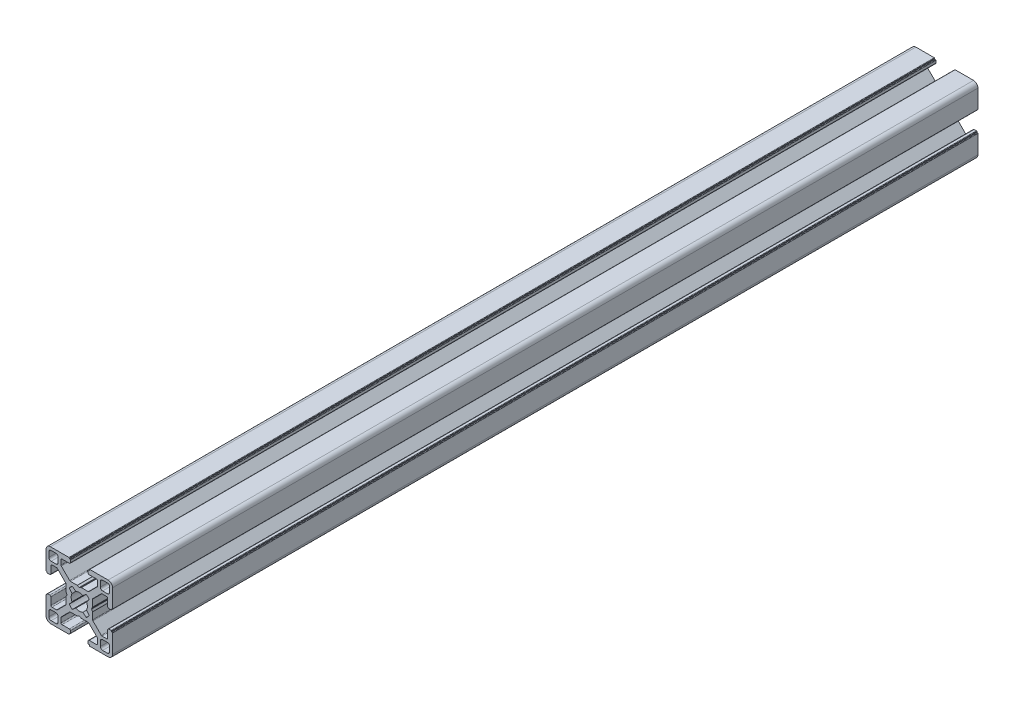
from build123d import *

# Parameters (mm, degrees)
SALIENTE_EXTRUIR1_DEPTH = 1000
CORTAR_EXTRUIR1_START   = -610
CORTAR_EXTRUIR1_DEPTH   = 610


with BuildPart() as part:
    # Croquis1 → Saliente-Extruir1 (new body)
    with BuildSketch(Plane.XY.offset(1000)):
        with BuildLine():
            Line((9.800000436, -10.500000436), (10.100000436, -10.500000436))
            ThreePointArc((10.100000436, -10.500000436), (10.241421792, -10.441421792), (10.300000436, -10.300000436))
            Line((10.300000436, -10.300000436), (10.300000436, -2))
            ThreePointArc((10.300000436, -2), (9.714213998, -0.585786438), (8.300000436, 0))
            Line((8.300000436, 0), (0, 0))
            ThreePointArc((0, 0), (-0.141421356, -0.058578644), (-0.2, -0.2))
            Line((-0.2, -0.2), (-0.2, -0.5))
            Line((-0.2, -0.5), (-0.49999919, -0.5))
            ThreePointArc((-0.49999919, -0.5), (-0.641420811, -0.558578753), (-0.699999564, -0.700000374))
            Line((-0.699999564, -0.700000374), (-0.699999564, -1.700000763))
            ThreePointArc((-0.699999564, -1.700000763), (-0.553552955, -2.053554154), (-0.199999564, -2.200000763))
            Line((-0.199999564, -2.200000763), (3.050000763, -2.200000763))
            ThreePointArc((3.050000763, -2.200000763), (3.403554154, -2.346447372), (3.550000763, -2.700000763))
            Line((3.550000763, -2.700000763), (3.550000763, -4.743055509))
            ThreePointArc((3.550000763, -4.743055509), (3.511993279, -4.934269826), (3.403749103, -5.096413843))
            Line((3.403749103, -5.096413843), (-0.349053376, -8.853358334))
            ThreePointArc((-0.349053376, -8.853358334), (-0.511332616, -8.961886981), (-0.702801716, -9))
            Line((-0.702801716, -9), (-3.746809419, -9))
            ThreePointArc((-3.746809419, -9), (-3.798212795, -9.006718618), (-3.846162576, -9.026423071))
            Line((-3.846162576, -9.026423071), (-4.600646407, -9.458279719))
            ThreePointArc((-4.600646407, -9.458279719), (-4.699999564, -9.48470279), (-4.799352721, -9.458279719))
            Line((-4.799352721, -9.458279719), (-5.553836552, -9.026423071))
            ThreePointArc((-5.553836552, -9.026423071), (-5.601786333, -9.006718618), (-5.653189709, -9))
            Line((-5.653189709, -9), (-8.697197412, -9))
            ThreePointArc((-8.697197412, -9), (-8.888666513, -8.961886981), (-9.050945752, -8.853358334))
            Line((-9.050945752, -8.853358334), (-12.803748231, -5.096413843))
            ThreePointArc((-12.803748231, -5.096413843), (-12.911992407, -4.934269826), (-12.949999891, -4.743055509))
            Line((-12.949999891, -4.743055509), (-12.949999891, -2.700000763))
            ThreePointArc((-12.949999891, -2.700000763), (-12.803553282, -2.346447372), (-12.449999891, -2.200000763))
            Line((-12.449999891, -2.200000763), (-9.199999564, -2.200000763))
            ThreePointArc((-9.199999564, -2.200000763), (-8.846446173, -2.053554154), (-8.699999564, -1.700000763))
            Line((-8.699999564, -1.700000763), (-8.699999564, -0.700000374))
            ThreePointArc((-8.699999564, -0.700000374), (-8.758578317, -0.558578753), (-8.899999938, -0.5))
            Line((-8.899999938, -0.5), (-9.199999128, -0.5))
            Line((-9.199999128, -0.5), (-9.199999128, -0.2))
            ThreePointArc((-9.199999128, -0.2), (-9.258577772, -0.058578644), (-9.399999128, 0))
            Line((-9.399999128, 0), (-17.699999564, 0))
            ThreePointArc((-17.699999564, 0), (-19.114213126, -0.585786438), (-19.699999564, -2))
            Line((-19.699999564, -2), (-19.699999564, -10.300000436))
            ThreePointArc((-19.699999564, -10.300000436), (-19.64142092, -10.441421792), (-19.499999564, -10.500000436))
            Line((-19.499999564, -10.500000436), (-19.199999564, -10.500000436))
            Line((-19.199999564, -10.500000436), (-19.199999564, -10.799999627))
            ThreePointArc((-19.199999564, -10.799999627), (-19.141420811, -10.941421247), (-18.99999919, -11))
            Line((-18.99999919, -11), (-17.999998801, -11))
            ThreePointArc((-17.999998801, -11), (-17.64644541, -10.853553391), (-17.499998801, -10.5))
            Line((-17.499998801, -10.5), (-17.499998801, -7.249999673))
            ThreePointArc((-17.499998801, -7.249999673), (-17.353552192, -6.896446283), (-16.999998801, -6.749999673))
            Line((-16.999998801, -6.749999673), (-14.956944055, -6.749999673))
            ThreePointArc((-14.956944055, -6.749999673), (-14.765729738, -6.788007157), (-14.603585721, -6.896251334))
            Line((-14.603585721, -6.896251334), (-10.84664123, -10.649053813))
            ThreePointArc((-10.84664123, -10.649053813), (-10.738112583, -10.811333052), (-10.699999564, -11.002802152))
            Line((-10.699999564, -11.002802152), (-10.699999564, -14.046809855))
            ThreePointArc((-10.699999564, -14.046809855), (-10.693280947, -14.098213232), (-10.673576493, -14.146163012))
            Line((-10.673576493, -14.146163012), (-10.241719845, -14.900646843))
            ThreePointArc((-10.241719845, -14.900646843), (-10.215296774, -15), (-10.241719845, -15.099353157))
            Line((-10.241719845, -15.099353157), (-10.673576493, -15.853836988))
            ThreePointArc((-10.673576493, -15.853836988), (-10.693280947, -15.901786769), (-10.699999564, -15.953190146))
            Line((-10.699999564, -15.953190146), (-10.699999564, -18.997197848))
            ThreePointArc((-10.699999564, -18.997197848), (-10.738112583, -19.188666949), (-10.84664123, -19.350946188))
            Line((-10.84664123, -19.350946188), (-14.603585721, -23.103748667))
            ThreePointArc((-14.603585721, -23.103748667), (-14.765729738, -23.211992843), (-14.956944055, -23.250000327))
            Line((-14.956944055, -23.250000327), (-16.999998801, -23.250000327))
            ThreePointArc((-16.999998801, -23.250000327), (-17.353552192, -23.103553718), (-17.499998801, -22.750000327))
            Line((-17.499998801, -22.750000327), (-17.499998801, -19.5))
            ThreePointArc((-17.499998801, -19.5), (-17.64644541, -19.14644661), (-17.999998801, -19))
            Line((-17.999998801, -19), (-18.99999919, -19))
            ThreePointArc((-18.99999919, -19), (-19.141420811, -19.058578753), (-19.199999564, -19.200000374))
            Line((-19.199999564, -19.200000374), (-19.199999564, -19.499999564))
            Line((-19.199999564, -19.499999564), (-19.499999564, -19.499999564))
            ThreePointArc((-19.499999564, -19.499999564), (-19.64142092, -19.558578208), (-19.699999564, -19.699999564))
            Line((-19.699999564, -19.699999564), (-19.699999564, -28))
            ThreePointArc((-19.699999564, -28), (-19.114213126, -29.414213563), (-17.699999564, -30))
            Line((-17.699999564, -30), (-9.399999128, -30))
            ThreePointArc((-9.399999128, -30), (-9.258577772, -29.941421356), (-9.199999128, -29.8))
            Line((-9.199999128, -29.8), (-9.199999128, -29.5))
            Line((-9.199999128, -29.5), (-8.899999938, -29.5))
            ThreePointArc((-8.899999938, -29.5), (-8.758578317, -29.441421247), (-8.699999564, -29.299999627))
            Line((-8.699999564, -29.299999627), (-8.699999564, -28.299999237))
            ThreePointArc((-8.699999564, -28.299999237), (-8.846446173, -27.946445847), (-9.199999564, -27.799999237))
            Line((-9.199999564, -27.799999237), (-12.449999891, -27.799999237))
            ThreePointArc((-12.449999891, -27.799999237), (-12.803553282, -27.653552628), (-12.949999891, -27.299999237))
            Line((-12.949999891, -27.299999237), (-12.949999891, -25.256944491))
            ThreePointArc((-12.949999891, -25.256944491), (-12.911992407, -25.065730174), (-12.803748231, -24.903586157))
            Line((-12.803748231, -24.903586157), (-9.050945752, -21.146641666))
            ThreePointArc((-9.050945752, -21.146641666), (-8.888666513, -21.038113019), (-8.697197412, -21))
            Line((-8.697197412, -21), (-5.653189709, -21))
            ThreePointArc((-5.653189709, -21), (-5.601786333, -20.993281383), (-5.553836552, -20.973576929))
            Line((-5.553836552, -20.973576929), (-4.799352721, -20.541720281))
            ThreePointArc((-4.799352721, -20.541720281), (-4.699999564, -20.51529721), (-4.600646407, -20.541720281))
            Line((-4.600646407, -20.541720281), (-3.846162576, -20.973576929))
            ThreePointArc((-3.846162576, -20.973576929), (-3.798212795, -20.993281383), (-3.746809419, -21))
            Line((-3.746809419, -21), (-0.702801716, -21))
            ThreePointArc((-0.702801716, -21), (-0.511332616, -21.038113019), (-0.349053377, -21.146641666))
            Line((-0.349053377, -21.146641666), (3.403749103, -24.903586157))
            ThreePointArc((3.403749103, -24.903586157), (3.511993279, -25.065730174), (3.550000763, -25.256944491))
            Line((3.550000763, -25.256944491), (3.550000763, -27.299999237))
            ThreePointArc((3.550000763, -27.299999237), (3.403554154, -27.653552628), (3.050000763, -27.799999237))
            Line((3.050000763, -27.799999237), (-0.199999564, -27.799999237))
            ThreePointArc((-0.199999564, -27.799999237), (-0.553552955, -27.946445847), (-0.699999564, -28.299999237))
            Line((-0.699999564, -28.299999237), (-0.699999564, -29.299999627))
            ThreePointArc((-0.699999564, -29.299999627), (-0.641420811, -29.441421247), (-0.49999919, -29.5))
            Line((-0.49999919, -29.5), (-0.2, -29.5))
            Line((-0.2, -29.5), (-0.2, -29.8))
            ThreePointArc((-0.2, -29.8), (-0.141421356, -29.941421356), (0, -30))
            Line((0, -30), (8.300000436, -30))
            ThreePointArc((8.300000436, -30), (9.714213998, -29.414213563), (10.300000436, -28))
            Line((10.300000436, -28), (10.300000436, -19.699999564))
            ThreePointArc((10.300000436, -19.699999564), (10.241421792, -19.558578208), (10.100000436, -19.499999564))
            Line((10.100000436, -19.499999564), (9.800000436, -19.499999564))
            Line((9.800000436, -19.499999564), (9.800000436, -19.200000374))
            ThreePointArc((9.800000436, -19.200000374), (9.741421683, -19.058578753), (9.600000062, -19))
            Line((9.600000062, -19), (8.599999673, -19))
            ThreePointArc((8.599999673, -19), (8.246446283, -19.14644661), (8.099999673, -19.5))
            Line((8.099999673, -19.5), (8.099999673, -22.750000327))
            ThreePointArc((8.099999673, -22.750000327), (7.953553064, -23.103553718), (7.599999673, -23.250000327))
            Line((7.599999673, -23.250000327), (5.556944927, -23.250000327))
            ThreePointArc((5.556944927, -23.250000327), (5.36573061, -23.211992843), (5.203586593, -23.103748667))
            Line((5.203586593, -23.103748667), (1.446642102, -19.350946188))
            ThreePointArc((1.446642102, -19.350946188), (1.338113455, -19.188666949), (1.300000436, -18.997197848))
            Line((1.300000436, -18.997197848), (1.300000436, -15.953190145))
            ThreePointArc((1.300000436, -15.953190145), (1.293281819, -15.901786769), (1.273577365, -15.853836988))
            Line((1.273577365, -15.853836988), (0.841720717, -15.099353157))
            ThreePointArc((0.841720717, -15.099353157), (0.815297646, -15), (0.841720717, -14.900646843))
            Line((0.841720717, -14.900646843), (1.273577365, -14.146163012))
            ThreePointArc((1.273577365, -14.146163012), (1.293281819, -14.098213231), (1.300000436, -14.046809855))
            Line((1.300000436, -14.046809855), (1.300000436, -11.002802152))
            ThreePointArc((1.300000436, -11.002802152), (1.338113455, -10.811333051), (1.446642102, -10.649053812))
            Line((1.446642102, -10.649053812), (5.203586593, -6.896251334))
            ThreePointArc((5.203586593, -6.896251334), (5.36573061, -6.788007157), (5.556944927, -6.749999673))
            Line((5.556944927, -6.749999673), (7.599999673, -6.749999673))
            ThreePointArc((7.599999673, -6.749999673), (7.953553064, -6.896446283), (8.099999673, -7.249999673))
            Line((8.099999673, -7.249999673), (8.099999673, -10.5))
            ThreePointArc((8.099999673, -10.5), (8.246446283, -10.853553391), (8.599999673, -11))
            Line((8.599999673, -11), (9.600000062, -11))
            ThreePointArc((9.600000062, -11), (9.741421683, -10.941421247), (9.800000436, -10.799999627))
            Line((9.800000436, -10.799999627), (9.800000436, -10.500000436))
        make_face()
        with BuildLine():
            Line((8.000001536, -5.500000365), (5.800000754, -5.500000365))
            ThreePointArc((5.800000754, -5.500000365), (5.092893979, -5.207107149), (4.800000763, -4.500000374))
            Line((4.800000763, -4.500000374), (4.800000763, -2.299999592))
            ThreePointArc((4.800000763, -2.299999592), (5.092893979, -1.592892818), (5.800000754, -1.299999602))
            Line((5.800000754, -1.299999602), (8.000001536, -1.299999602))
            ThreePointArc((8.000001536, -1.299999602), (8.70710831, -1.592892818), (9.000001526, -2.299999592))
            Line((9.000001526, -2.299999592), (9.000001526, -4.500000374))
            ThreePointArc((9.000001526, -4.500000374), (8.70710831, -5.207107149), (8.000001536, -5.500000365))
        make_face(mode=Mode.SUBTRACT)
        with BuildLine():
            Line((-15.199999881, -5.500000365), (-17.400000663, -5.500000365))
            ThreePointArc((-17.400000663, -5.500000365), (-18.107107438, -5.207107149), (-18.400000654, -4.500000374))
            Line((-18.400000654, -4.500000374), (-18.400000654, -2.299999592))
            ThreePointArc((-18.400000654, -2.299999592), (-18.107107438, -1.592892818), (-17.400000664, -1.299999602))
            Line((-17.400000664, -1.299999602), (-15.199999881, -1.299999602))
            ThreePointArc((-15.199999881, -1.299999602), (-14.492893107, -1.592892818), (-14.199999891, -2.299999592))
            Line((-14.199999891, -2.299999592), (-14.199999891, -4.500000374))
            ThreePointArc((-14.199999891, -4.500000374), (-14.492893107, -5.207107149), (-15.199999881, -5.500000365))
        make_face(mode=Mode.SUBTRACT)
        with BuildLine():
            Line((-17.400000664, -24.499999636), (-15.199999881, -24.499999636))
            ThreePointArc((-15.199999881, -24.499999636), (-14.492893107, -24.792892852), (-14.199999891, -25.499999626))
            Line((-14.199999891, -25.499999626), (-14.199999891, -27.700000408))
            ThreePointArc((-14.199999891, -27.700000408), (-14.492893107, -28.407107183), (-15.199999881, -28.700000399))
            Line((-15.199999881, -28.700000399), (-17.400000663, -28.700000399))
            ThreePointArc((-17.400000663, -28.700000399), (-18.107107438, -28.407107183), (-18.400000654, -27.700000408))
            Line((-18.400000654, -27.700000408), (-18.400000654, -25.499999626))
            ThreePointArc((-18.400000654, -25.499999626), (-18.107107438, -24.792892852), (-17.400000664, -24.499999636))
        make_face(mode=Mode.SUBTRACT)
        with BuildLine():
            Line((5.800000754, -24.499999636), (8.000001536, -24.499999636))
            ThreePointArc((8.000001536, -24.499999636), (8.70710831, -24.792892852), (9.000001526, -25.499999626))
            Line((9.000001526, -25.499999626), (9.000001526, -27.700000408))
            ThreePointArc((9.000001526, -27.700000408), (8.70710831, -28.407107183), (8.000001536, -28.700000399))
            Line((8.000001536, -28.700000399), (5.800000754, -28.700000399))
            ThreePointArc((5.800000754, -28.700000399), (5.092893979, -28.407107183), (4.800000763, -27.700000408))
            Line((4.800000763, -27.700000408), (4.800000763, -25.499999626))
            ThreePointArc((4.800000763, -25.499999626), (5.092893979, -24.792892852), (5.800000754, -24.499999636))
        make_face(mode=Mode.SUBTRACT)
        with BuildLine():
            Line((-7.835928976, -10.481599097), (-6.300129088, -11.719438233))
            ThreePointArc((-6.300129088, -11.719438233), (-4.699999564, -11.35), (-3.09987004, -11.719438233))
            Line((-3.09987004, -11.719438233), (-1.564070152, -10.481599097))
            ThreePointArc((-1.564070152, -10.481599097), (-0.818997305, -11.10284444), (-0.194662672, -11.845330527))
            Line((-0.194662672, -11.845330527), (-1.419437832, -13.399870404))
            ThreePointArc((-1.419437832, -13.399870404), (-1.049999564, -15), (-1.419437832, -16.600129597))
            Line((-1.419437832, -16.600129597), (-0.194662672, -18.154669473))
            ThreePointArc((-0.194662672, -18.154669473), (-0.818997305, -18.897155561), (-1.564070152, -19.518400903))
            Line((-1.564070152, -19.518400903), (-3.09987004, -18.280561767))
            ThreePointArc((-3.09987004, -18.280561767), (-4.699999564, -18.65), (-6.300129088, -18.280561767))
            Line((-6.300129088, -18.280561767), (-7.835928976, -19.518400903))
            ThreePointArc((-7.835928976, -19.518400903), (-8.581001823, -18.897155561), (-9.205336456, -18.154669473))
            Line((-9.205336456, -18.154669473), (-7.980561295, -16.600129597))
            ThreePointArc((-7.980561295, -16.600129597), (-8.349999564, -15), (-7.980561296, -13.399870404))
            Line((-7.980561296, -13.399870404), (-9.205336456, -11.845330527))
            ThreePointArc((-9.205336456, -11.845330527), (-8.581001823, -11.10284444), (-7.835928976, -10.481599097))
        make_face(mode=Mode.SUBTRACT)
    extrude(amount=-SALIENTE_EXTRUIR1_DEPTH)

    # Croquis4 → Cortar-Extruir1 (cut)
    with BuildSketch(Plane(origin=(0, 0, 0), x_dir=(-1, 0, 0), z_dir=(0, 0, -1)).offset(CORTAR_EXTRUIR1_START)):
        with BuildLine():
            Line((-9.800000436, -10.500000436), (-9.800000436, -10.799999627))
            ThreePointArc((-9.800000436, -10.799999627), (-9.741421683, -10.941421247), (-9.600000062, -11))
            Line((-9.600000062, -11), (-8.599999673, -11))
            ThreePointArc((-8.599999673, -11), (-8.246446283, -10.853553391), (-8.099999673, -10.5))
            Line((-8.099999673, -10.5), (-8.099999673, -7.249999673))
            ThreePointArc((-8.099999673, -7.249999673), (-7.953553064, -6.896446283), (-7.599999673, -6.749999673))
            Line((-7.599999673, -6.749999673), (-5.556944927, -6.749999673))
            ThreePointArc((-5.556944927, -6.749999673), (-5.36573061, -6.788007157), (-5.203586593, -6.896251334))
            Line((-5.203586593, -6.896251334), (-1.446642102, -10.649053812))
            ThreePointArc((-1.446642102, -10.649053812), (-1.338113455, -10.811333051), (-1.300000436, -11.002802152))
            Line((-1.300000436, -11.002802152), (-1.300000436, -14.046809855))
            ThreePointArc((-1.300000436, -14.046809855), (-1.293281819, -14.098213231), (-1.273577365, -14.146163012))
            Line((-1.273577365, -14.146163012), (-0.841720717, -14.900646843))
            ThreePointArc((-0.841720717, -14.900646843), (-0.815297646, -15), (-0.841720717, -15.099353157))
            Line((-0.841720717, -15.099353157), (-1.273577365, -15.853836988))
            ThreePointArc((-1.273577365, -15.853836988), (-1.293281819, -15.901786769), (-1.300000436, -15.953190145))
            Line((-1.300000436, -15.953190145), (-1.300000436, -18.997197848))
            ThreePointArc((-1.300000436, -18.997197848), (-1.338113455, -19.188666949), (-1.446642102, -19.350946188))
            Line((-1.446642102, -19.350946188), (-5.203586593, -23.103748667))
            ThreePointArc((-5.203586593, -23.103748667), (-5.36573061, -23.211992843), (-5.556944927, -23.250000327))
            Line((-5.556944927, -23.250000327), (-7.599999673, -23.250000327))
            ThreePointArc((-7.599999673, -23.250000327), (-7.953553064, -23.103553718), (-8.099999673, -22.750000327))
            Line((-8.099999673, -22.750000327), (-8.099999673, -19.5))
            ThreePointArc((-8.099999673, -19.5), (-8.246446283, -19.14644661), (-8.599999673, -19))
            Line((-8.599999673, -19), (-9.600000062, -19))
            ThreePointArc((-9.600000062, -19), (-9.741421683, -19.058578753), (-9.800000436, -19.200000374))
            Line((-9.800000436, -19.200000374), (-9.800000436, -19.499999564))
            Line((-9.800000436, -19.499999564), (-10.100000436, -19.499999564))
            ThreePointArc((-10.100000436, -19.499999564), (-10.241421792, -19.558578208), (-10.300000436, -19.699999564))
            Line((-10.300000436, -19.699999564), (-10.300000436, -28))
            ThreePointArc((-10.300000436, -28), (-9.714213998, -29.414213563), (-8.300000436, -30))
            Line((-8.300000436, -30), (0, -30))
            ThreePointArc((0, -30), (0.141421356, -29.941421356), (0.2, -29.8))
            Line((0.2, -29.8), (0.2, -29.5))
            Line((0.2, -29.5), (0.49999919, -29.5))
            ThreePointArc((0.49999919, -29.5), (0.641420811, -29.441421247), (0.699999564, -29.299999627))
            Line((0.699999564, -29.299999627), (0.699999564, -28.299999237))
            ThreePointArc((0.699999564, -28.299999237), (0.553552955, -27.946445847), (0.199999564, -27.799999237))
            Line((0.199999564, -27.799999237), (-3.050000763, -27.799999237))
            ThreePointArc((-3.050000763, -27.799999237), (-3.403554154, -27.653552628), (-3.550000763, -27.299999237))
            Line((-3.550000763, -27.299999237), (-3.550000763, -25.256944491))
            ThreePointArc((-3.550000763, -25.256944491), (-3.511993279, -25.065730174), (-3.403749103, -24.903586157))
            Line((-3.403749103, -24.903586157), (0.349053377, -21.146641666))
            ThreePointArc((0.349053377, -21.146641666), (0.511332616, -21.038113019), (0.702801716, -21))
            Line((0.702801716, -21), (3.746809419, -21))
            ThreePointArc((3.746809419, -21), (3.798212795, -20.993281383), (3.846162576, -20.973576929))
            Line((3.846162576, -20.973576929), (4.600646407, -20.541720281))
            ThreePointArc((4.600646407, -20.541720281), (4.699999564, -20.51529721), (4.799352721, -20.541720281))
            Line((4.799352721, -20.541720281), (5.553836552, -20.973576929))
            ThreePointArc((5.553836552, -20.973576929), (5.601786333, -20.993281383), (5.653189709, -21))
            Line((5.653189709, -21), (8.697197412, -21))
            ThreePointArc((8.697197412, -21), (8.888666513, -21.038113019), (9.050945752, -21.146641666))
            Line((9.050945752, -21.146641666), (12.803748231, -24.903586157))
            ThreePointArc((12.803748231, -24.903586157), (12.911992407, -25.065730174), (12.949999891, -25.256944491))
            Line((12.949999891, -25.256944491), (12.949999891, -27.299999237))
            ThreePointArc((12.949999891, -27.299999237), (12.803553282, -27.653552628), (12.449999891, -27.799999237))
            Line((12.449999891, -27.799999237), (9.199999564, -27.799999237))
            ThreePointArc((9.199999564, -27.799999237), (8.846446173, -27.946445847), (8.699999564, -28.299999237))
            Line((8.699999564, -28.299999237), (8.699999564, -29.299999627))
            ThreePointArc((8.699999564, -29.299999627), (8.758578317, -29.441421247), (8.899999938, -29.5))
            Line((8.899999938, -29.5), (9.199999128, -29.5))
            Line((9.199999128, -29.5), (9.199999128, -29.8))
            ThreePointArc((9.199999128, -29.8), (9.258577772, -29.941421356), (9.399999128, -30))
            Line((9.399999128, -30), (17.699999564, -30))
            ThreePointArc((17.699999564, -30), (19.114213126, -29.414213563), (19.699999564, -28))
            Line((19.699999564, -28), (19.699999564, -19.699999564))
            ThreePointArc((19.699999564, -19.699999564), (19.64142092, -19.558578208), (19.499999564, -19.499999564))
            Line((19.499999564, -19.499999564), (19.199999564, -19.499999564))
            Line((19.199999564, -19.499999564), (19.199999564, -19.200000374))
            ThreePointArc((19.199999564, -19.200000374), (19.141420811, -19.058578753), (18.99999919, -19))
            Line((18.99999919, -19), (17.999998801, -19))
            ThreePointArc((17.999998801, -19), (17.64644541, -19.14644661), (17.499998801, -19.5))
            Line((17.499998801, -19.5), (17.499998801, -22.750000327))
            ThreePointArc((17.499998801, -22.750000327), (17.353552192, -23.103553718), (16.999998801, -23.250000327))
            Line((16.999998801, -23.250000327), (14.956944055, -23.250000327))
            ThreePointArc((14.956944055, -23.250000327), (14.765729738, -23.211992843), (14.603585721, -23.103748667))
            Line((14.603585721, -23.103748667), (10.84664123, -19.350946188))
            ThreePointArc((10.84664123, -19.350946188), (10.738112583, -19.188666949), (10.699999564, -18.997197848))
            Line((10.699999564, -18.997197848), (10.699999564, -15.953190146))
            ThreePointArc((10.699999564, -15.953190146), (10.693280947, -15.901786769), (10.673576493, -15.853836988))
            Line((10.673576493, -15.853836988), (10.241719845, -15.099353157))
            ThreePointArc((10.241719845, -15.099353157), (10.215296774, -15), (10.241719845, -14.900646843))
            Line((10.241719845, -14.900646843), (10.673576493, -14.146163012))
            ThreePointArc((10.673576493, -14.146163012), (10.693280947, -14.098213232), (10.699999564, -14.046809855))
            Line((10.699999564, -14.046809855), (10.699999564, -11.002802152))
            ThreePointArc((10.699999564, -11.002802152), (10.738112583, -10.811333052), (10.84664123, -10.649053813))
            Line((10.84664123, -10.649053813), (14.603585721, -6.896251334))
            ThreePointArc((14.603585721, -6.896251334), (14.765729738, -6.788007157), (14.956944055, -6.749999673))
            Line((14.956944055, -6.749999673), (16.999998801, -6.749999673))
            ThreePointArc((16.999998801, -6.749999673), (17.353552192, -6.896446283), (17.499998801, -7.249999673))
            Line((17.499998801, -7.249999673), (17.499998801, -10.5))
            ThreePointArc((17.499998801, -10.5), (17.64644541, -10.853553391), (17.999998801, -11))
            Line((17.999998801, -11), (18.99999919, -11))
            ThreePointArc((18.99999919, -11), (19.141420811, -10.941421247), (19.199999564, -10.799999627))
            Line((19.199999564, -10.799999627), (19.199999564, -10.500000436))
            Line((19.199999564, -10.500000436), (19.499999564, -10.500000436))
            ThreePointArc((19.499999564, -10.500000436), (19.64142092, -10.441421792), (19.699999564, -10.300000436))
            Line((19.699999564, -10.300000436), (19.699999564, -2))
            ThreePointArc((19.699999564, -2), (19.114213126, -0.585786438), (17.699999564, 0))
            Line((17.699999564, 0), (9.399999128, 0))
            ThreePointArc((9.399999128, 0), (9.258577772, -0.058578644), (9.199999128, -0.2))
            Line((9.199999128, -0.2), (9.199999128, -0.5))
            Line((9.199999128, -0.5), (8.899999938, -0.5))
            ThreePointArc((8.899999938, -0.5), (8.758578317, -0.558578753), (8.699999564, -0.700000374))
            Line((8.699999564, -0.700000374), (8.699999564, -1.700000763))
            ThreePointArc((8.699999564, -1.700000763), (8.846446173, -2.053554154), (9.199999564, -2.200000763))
            Line((9.199999564, -2.200000763), (12.449999891, -2.200000763))
            ThreePointArc((12.449999891, -2.200000763), (12.803553282, -2.346447372), (12.949999891, -2.700000763))
            Line((12.949999891, -2.700000763), (12.949999891, -4.743055509))
            ThreePointArc((12.949999891, -4.743055509), (12.911992407, -4.934269826), (12.803748231, -5.096413843))
            Line((12.803748231, -5.096413843), (9.050945752, -8.853358334))
            ThreePointArc((9.050945752, -8.853358334), (8.888666513, -8.961886981), (8.697197412, -9))
            Line((8.697197412, -9), (5.653189709, -9))
            ThreePointArc((5.653189709, -9), (5.601786333, -9.006718618), (5.553836552, -9.026423071))
            Line((5.553836552, -9.026423071), (4.799352721, -9.458279719))
            ThreePointArc((4.799352721, -9.458279719), (4.699999564, -9.48470279), (4.600646407, -9.458279719))
            Line((4.600646407, -9.458279719), (3.846162576, -9.026423071))
            ThreePointArc((3.846162576, -9.026423071), (3.798212795, -9.006718618), (3.746809419, -9))
            Line((3.746809419, -9), (0.702801716, -9))
            ThreePointArc((0.702801716, -9), (0.511332616, -8.961886981), (0.349053376, -8.853358334))
            Line((0.349053376, -8.853358334), (-3.403749103, -5.096413843))
            ThreePointArc((-3.403749103, -5.096413843), (-3.511993279, -4.934269826), (-3.550000763, -4.743055509))
            Line((-3.550000763, -4.743055509), (-3.550000763, -2.700000763))
            ThreePointArc((-3.550000763, -2.700000763), (-3.403554154, -2.346447372), (-3.050000763, -2.200000763))
            Line((-3.050000763, -2.200000763), (0.199999564, -2.200000763))
            ThreePointArc((0.199999564, -2.200000763), (0.553552955, -2.053554154), (0.699999564, -1.700000763))
            Line((0.699999564, -1.700000763), (0.699999564, -0.700000374))
            ThreePointArc((0.699999564, -0.700000374), (0.641420811, -0.558578753), (0.49999919, -0.5))
            Line((0.49999919, -0.5), (0.2, -0.5))
            Line((0.2, -0.5), (0.2, -0.2))
            ThreePointArc((0.2, -0.2), (0.141421356, -0.058578644), (0, 0))
            Line((0, 0), (-8.300000436, 0))
            ThreePointArc((-8.300000436, 0), (-9.714213998, -0.585786438), (-10.300000436, -2))
            Line((-10.300000436, -2), (-10.300000436, -10.300000436))
            ThreePointArc((-10.300000436, -10.300000436), (-10.241421792, -10.441421792), (-10.100000436, -10.500000436))
            Line((-10.100000436, -10.500000436), (-9.800000436, -10.500000436))
        make_face()
    extrude(amount=CORTAR_EXTRUIR1_DEPTH, mode=Mode.SUBTRACT)


solid = part.part
